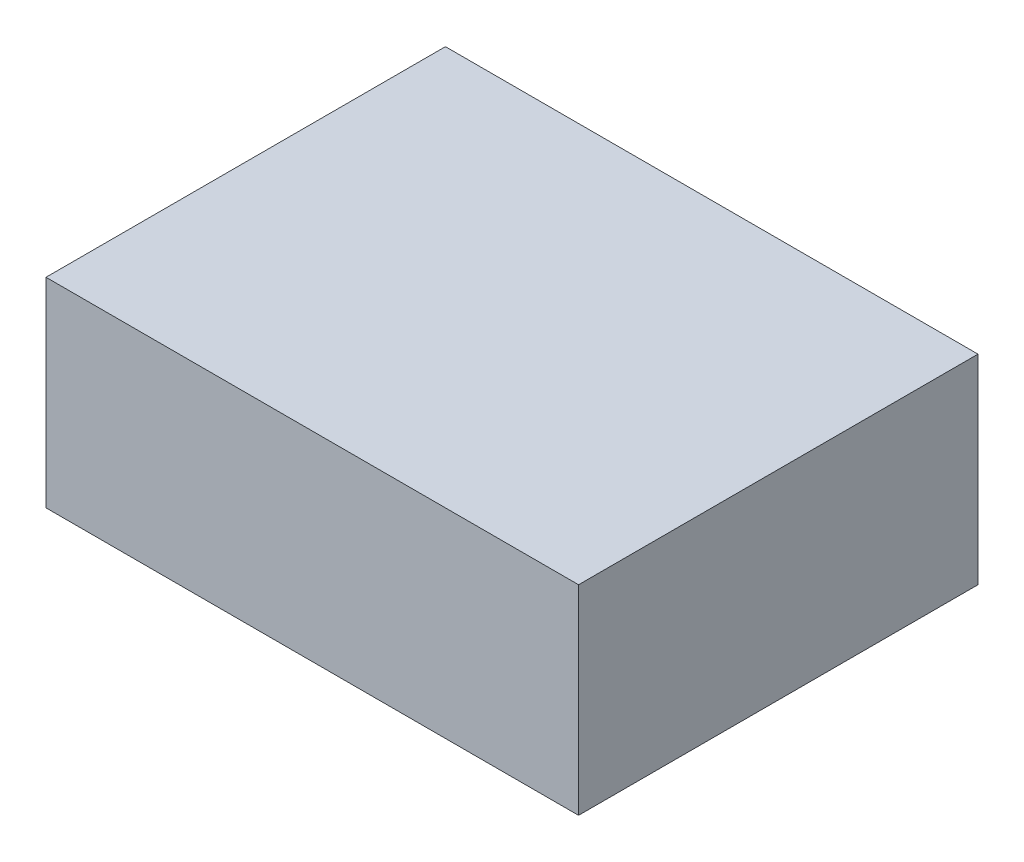
from build123d import *

# Parameters (mm, degrees)
SKETCH2_W          = 203.2
SKETCH2_H          = 152.4
LINK2_DEPTH        = 76.2
SKETCH3_R          = 25.4
CUT_EXTRUDE1_DEPTH = 25.4
SKETCH4_W          = 127
SKETCH4_H          = 25.4
CUT_EXTRUDE2_DEPTH = 177.8


with BuildPart() as part:
    # Sketch2 → link2 (new body)
    with BuildSketch(Plane(origin=(0, 0, 0), x_dir=(1, 0, 0), z_dir=(0, 1, 0))):
        Rectangle(SKETCH2_W, SKETCH2_H)
    extrude(amount=LINK2_DEPTH)

    # Sketch3 → Cut-Extrude1 (cut)
    with BuildSketch(Plane.XZ):
        with Locations(Location((50.8, 0, 0), (0, 0, 270))):
            Circle(SKETCH3_R)
    extrude(amount=-CUT_EXTRUDE1_DEPTH, mode=Mode.SUBTRACT)

    # Sketch4 → Cut-Extrude2 (cut)
    with BuildSketch(Plane.ZY.offset(101.6)):
        with Locations((0, 50.8)):
            Rectangle(SKETCH4_W, SKETCH4_H)
    extrude(amount=-CUT_EXTRUDE2_DEPTH, mode=Mode.SUBTRACT)


solid = part.part
